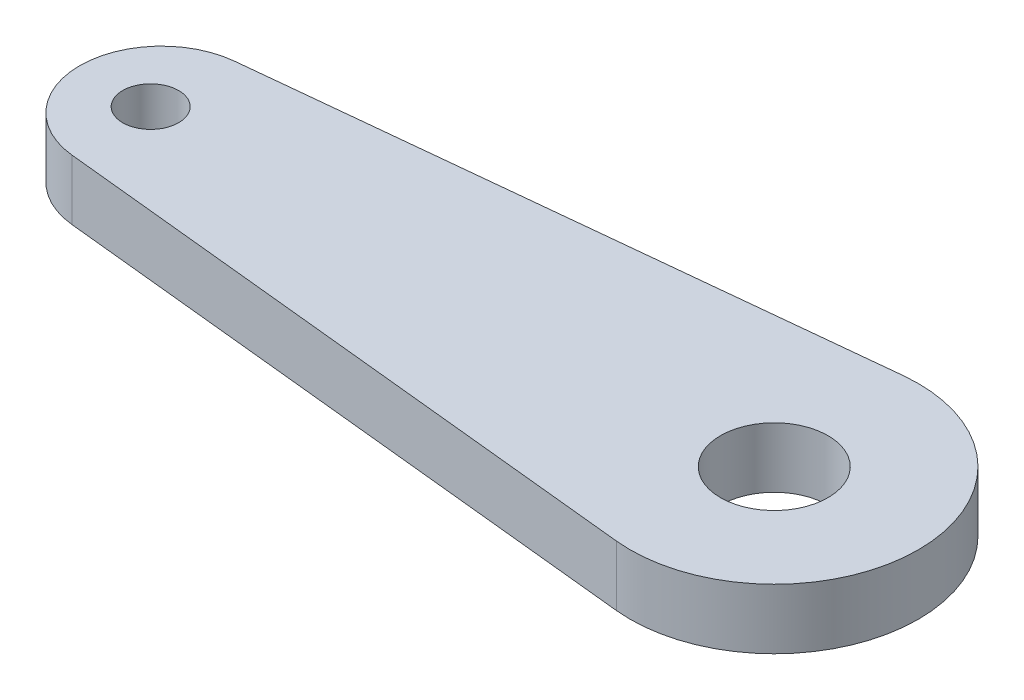
from build123d import *

# Parameters (mm, degrees)
SKETCH1_R           = 0.65
SKETCH1_R_2         = 3.35
SKETCH1_R_3         = 1.25
BOSS_EXTRUDE1_DEPTH = 1.4


with BuildPart() as part:
    # Sketch1 → Boss-Extrude1 (new body)
    # profile 1 of 4: a face of its own
    with BuildSketch(Plane(origin=(0, 0, 0), x_dir=(1, 0, 0), z_dir=(0, 1, 0))):
        with BuildLine():
            Line((-0.340877193, 3.332612), (-14.443333333, 1.890138149))
            ThreePointArc((-14.443333333, 1.890138149), (-12.976684119, 1.410200931), (-12.35, 0))
            ThreePointArc((-12.35, 0), (-12.976684119, -1.410200931), (-14.443333333, -1.890138149))
            Line((-14.443333333, -1.890138149), (-0.340877193, -3.332612))
            ThreePointArc((-0.340877193, -3.332612), (-3.35, 0), (-0.340877193, 3.332612))
        make_face()
    # profile 2 of 4: a face of its own
    with BuildSketch(Plane(origin=(0, 0, 0), x_dir=(1, 0, 0), z_dir=(0, 1, 0))):
        with BuildLine():
            ThreePointArc((-12.35, 0), (-12.976684119, 1.410200931), (-14.443333333, 1.890138149))
            ThreePointArc((-14.443333333, 1.890138149), (-16.15, 0), (-14.443333333, -1.890138149))
            ThreePointArc((-14.443333333, -1.890138149), (-12.976684119, -1.410200931), (-12.35, 0))
        make_face()
        with Locations(Location((-14.5, 0, 0), (0, 0, 270))):
            Circle(SKETCH1_R, mode=Mode.SUBTRACT)
    # profile 3 of 4: a face of its own
    with BuildSketch(Plane(origin=(0, 0, 0), x_dir=(1, 0, 0), z_dir=(0, 1, 0))):
        Circle(SKETCH1_R_2)
        with Locations(Location((0, 0, 0), (0, 0, 270))):
            Circle(SKETCH1_R_3, mode=Mode.SUBTRACT)
    # profile 4 of 4: a face of its own
    with BuildSketch(Plane(origin=(0, 0, 0), x_dir=(1, 0, 0), z_dir=(0, 1, 0))):
        with BuildLine():
            ThreePointArc((3.35, 0), (2.245056948, 2.486406905), (-0.340877193, 3.332612))
            ThreePointArc((-0.340877193, 3.332612), (-3.35, 0), (-0.340877193, -3.332612))
            ThreePointArc((-0.340877193, -3.332612), (2.245056948, -2.486406905), (3.35, 0))
        make_face()
        with Locations(Location((0, 0, 0), (0, 0, 270))):
            Circle(SKETCH1_R_3, mode=Mode.SUBTRACT)
    extrude(amount=BOSS_EXTRUDE1_DEPTH)


solid = part.part
